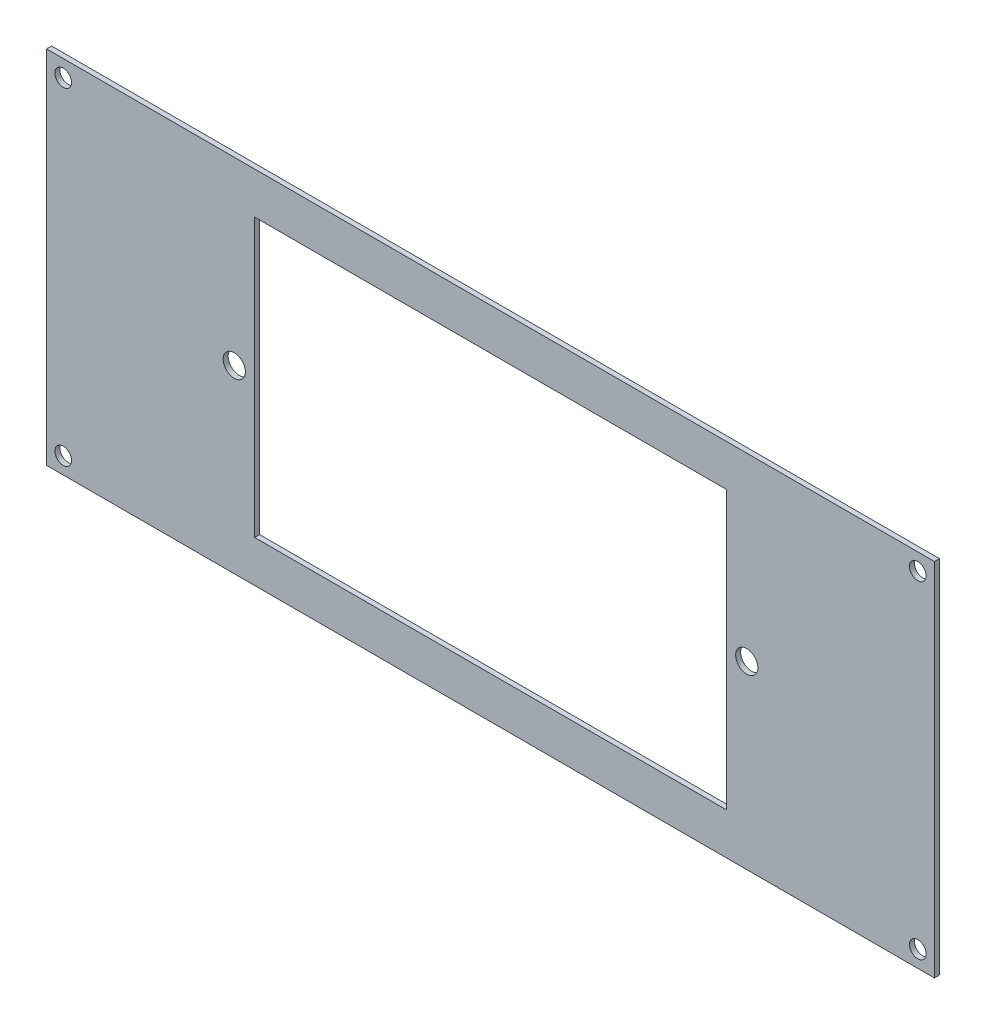
from build123d import *

# Parameters (mm, degrees)
ESQUISSE1_W             = 160
ESQUISSE1_H             = 65
ESQUISSE1_R             = 1.5
BOSS_EXTRU_1_DEPTH      = 0.9
ESQUISSE2_W             = 85
ESQUISSE2_H             = 50
ESQUISSE2_R             = 2
ENL_V_MAT_EXTRU_1_DEPTH = 0.9


with BuildPart() as part:
    # Esquisse1 → Boss.-Extru.1 (new body)
    with BuildSketch(Plane.XY):
        with Locations((80, 32.5)):
            Rectangle(ESQUISSE1_W, ESQUISSE1_H)
        with Locations((3, 62)):
            Circle(ESQUISSE1_R, mode=Mode.SUBTRACT)
        with Locations((3, 3)):
            Circle(ESQUISSE1_R, mode=Mode.SUBTRACT)
        with Locations((157, 3)):
            Circle(ESQUISSE1_R, mode=Mode.SUBTRACT)
        with Locations((157, 62)):
            Circle(ESQUISSE1_R, mode=Mode.SUBTRACT)
    extrude(amount=BOSS_EXTRU_1_DEPTH)

    # Esquisse2 → Enlèv. mat.-Extru.1 (cut)
    with BuildSketch(Plane.XY.offset(0.9)):
        with Locations((80, 32.5)):
            Rectangle(ESQUISSE2_W, ESQUISSE2_H)
        with Locations((33.825, 32.5)):
            Circle(ESQUISSE2_R)
        with Locations((126.175, 32.5)):
            Circle(ESQUISSE2_R)
    extrude(amount=-ENL_V_MAT_EXTRU_1_DEPTH, mode=Mode.SUBTRACT)


solid = part.part
